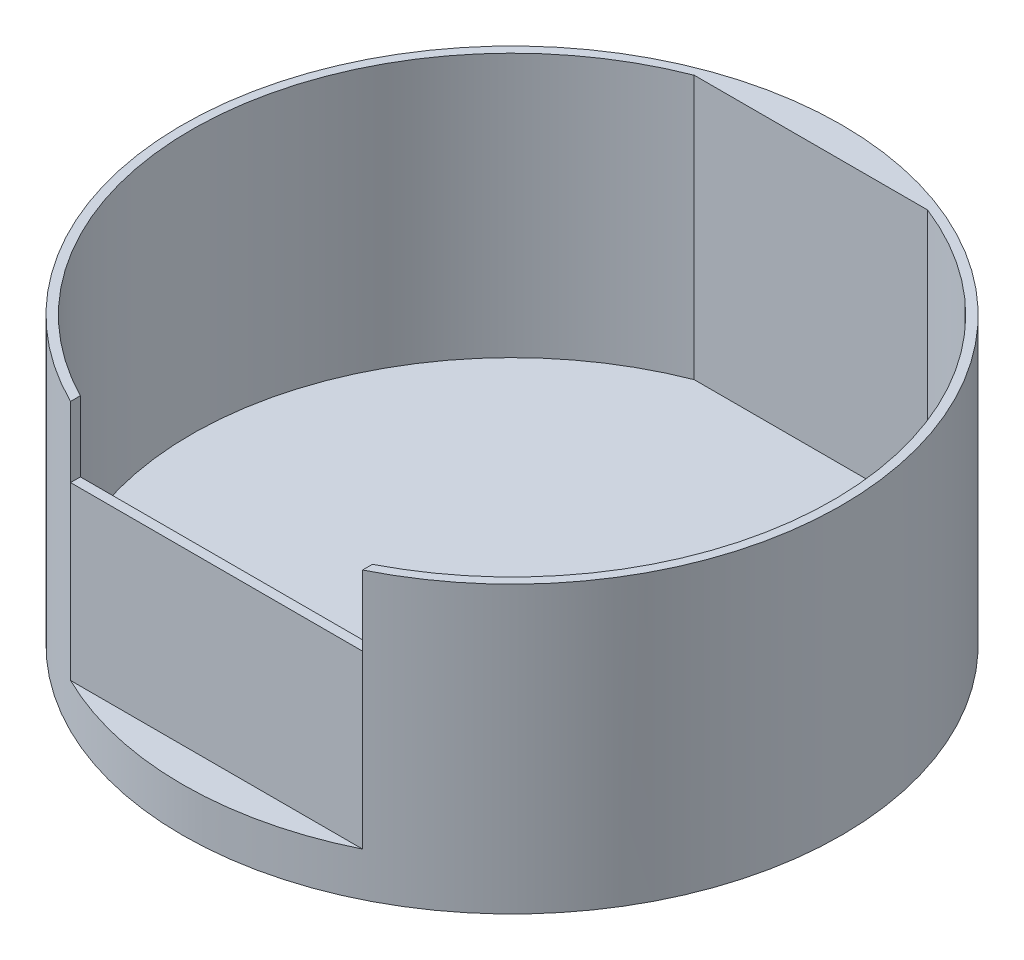
from build123d import *

# Parameters (mm, degrees)
SKETCH1_R                  = 75
BOSS_EXTRUDE1_DEPTH        = 5
SKETCH2_R                  = 75
SKETCH2_R_2                = 73
BOSS_EXTRUDE2_DEPTH        = 60
BOSS_EXTRUDE3_START        = -60
BOSS_EXTRUDE3_DEPTH        = 60
F_10_0MM_DOWEL_HOLE1_D     = 10
F_10_0MM_DOWEL_HOLE1_DEPTH = 5
F_10_0MM_DOWEL_HOLE1_TIP   = 3.004303095
CUT_EXTRUDE1_REACH         = 173.61
CUT_EXTRUDE1_END_RADIUS    = 75
SKETCH7_W                  = 66.452990904
SKETCH7_H                  = 16
CUT_EXTRUDE2_START         = -39
CUT_EXTRUDE2_DEPTH         = 39


with BuildPart() as part:
    # Sketch1 → Boss-Extrude1 (new body)
    with BuildSketch(Plane(origin=(0, 0, 0), x_dir=(1, 0, 0), z_dir=(0, 1, 0))):
        with Locations(Location((0, 0, 0), (0, 0, 270))):
            Circle(SKETCH1_R)
    extrude(amount=BOSS_EXTRUDE1_DEPTH)

    # Sketch2 → Boss-Extrude2 (add)
    with BuildSketch(Plane(origin=(0, 5, 0), x_dir=(1, 0, 0), z_dir=(0, 1, 0))):
        with Locations(Location((0, 0, 0), (0, 0, 270))):
            Circle(SKETCH2_R)
        with Locations(Location((0, 0, 0), (0, 0, 270))):
            Circle(SKETCH2_R_2, mode=Mode.SUBTRACT)
    extrude(amount=BOSS_EXTRUDE2_DEPTH)

    # Sketch3 → Boss-Extrude3 (add)
    with BuildSketch(Plane(origin=(0, 65, 0), x_dir=(1, 0, 0), z_dir=(0, 1, 0)).offset(BOSS_EXTRUDE3_START)):
        with BuildLine():
            ThreePointArc((26.551836095, 68), (0, 73), (-26.551836095, 68))
            Line((-26.551836095, 68), (26.551836095, 68))
        make_face()
        with BuildLine():
            ThreePointArc((31.638584039, 68), (0, 75), (-31.638584039, 68))
            Line((-31.638584039, 68), (-26.551836095, 68))
            ThreePointArc((-26.551836095, 68), (0, 73), (26.551836095, 68))
            Line((26.551836095, 68), (31.638584039, 68))
        make_face()
        with BuildLine():
            Line((-33.226495452, -65), (-37.416573868, -65))
            ThreePointArc((-37.416573868, -65), (0, -75), (37.416573868, -65))
            Line((37.416573868, -65), (33.226495452, -65))
            ThreePointArc((33.226495452, -65), (0, -73), (-33.226495452, -65))
        make_face()
        with BuildLine():
            Line((33.226495452, -65), (-33.226495452, -65))
            ThreePointArc((-33.226495452, -65), (0, -73), (33.226495452, -65))
        make_face()
    extrude(amount=BOSS_EXTRUDE3_DEPTH)

    # Ø10.0mm Dowel Hole1
    with Locations(Plane(origin=(0, 5, 0), x_dir=(1, 0, 0), z_dir=(0, 1, 0))):
        with Locations((0, 0)):
            Hole(F_10_0MM_DOWEL_HOLE1_D / 2, depth=F_10_0MM_DOWEL_HOLE1_DEPTH)
            with Locations((0, 0, -(F_10_0MM_DOWEL_HOLE1_DEPTH + F_10_0MM_DOWEL_HOLE1_TIP / 2))):  # 118° drill point
                Cone(0, F_10_0MM_DOWEL_HOLE1_D / 2, F_10_0MM_DOWEL_HOLE1_TIP, mode=Mode.SUBTRACT)

    # Cut-Extrude1: up to this cylinder (the profile starts inside it)
    cut_extrude1_end = Plane(origin=(0, 57, 0), z_dir=(0, -1, 0)) * Cylinder(CUT_EXTRUDE1_END_RADIUS, 498.22, mode=Mode.PRIVATE)
    # Sketch7 → Cut-Extrude1 (cut, up to the surface)
    with BuildSketch(Plane(origin=(0, 0, 65), x_dir=(-1, 0, 0), z_dir=(0, 0, -1)), mode=Mode.PRIVATE) as cut_extrude1_sk1:
        with Locations((0, 57)):
            Rectangle(SKETCH7_W, SKETCH7_H)
    cut_extrude1_tool1 = extrude(cut_extrude1_sk1.sketch, amount=-CUT_EXTRUDE1_REACH, mode=Mode.PRIVATE) & cut_extrude1_end
    add(cut_extrude1_tool1.solids().sort_by_distance((0, 57, 65))[0], mode=Mode.SUBTRACT)

    # Sketch8 → Cut-Extrude2 (cut)
    with BuildSketch(Plane(origin=(0, 49, 0), x_dir=(1, 0, 0), z_dir=(0, 1, 0)).offset(CUT_EXTRUDE2_START)):
        with BuildLine():
            Line((-33.226495452, -67.238381896), (33.226495452, -67.238381896))
            ThreePointArc((33.226495452, -67.238381896), (0, -75), (-33.226495452, -67.238381896))
        make_face()
    extrude(amount=CUT_EXTRUDE2_DEPTH, mode=Mode.SUBTRACT)


solid = part.part
